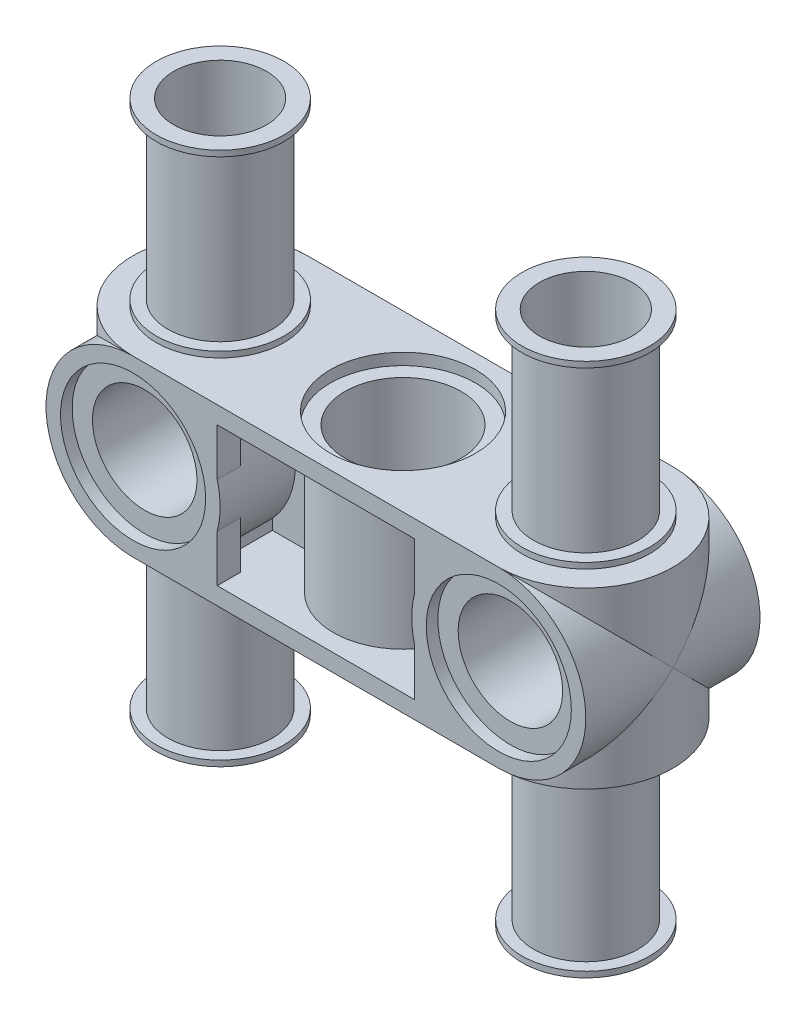
from build123d import *
from build123d.topology import SkipClean

# Parameters (mm, degrees)
EXTRUDE1_DEPTH     = 3.81
SKETCH2_R          = 2.794
CUT_EXTRUDE1_DEPTH = 0.254
SKETCH3_R          = 2.794
EXTRUDE2_DEPTH     = 0.254
SKETCH5_R          = 2.286
SKETCH5_R_2        = 2.032
EXTRUDE4_DEPTH     = 7.366
SKETCH6_R          = 2.794
SKETCH6_R_2        = 2.032
EXTRUDE5_DEPTH     = 0.254
EXTRUDE6_DEPTH     = 7.112
SKETCH8_R          = 2.54
CUT_EXTRUDE2_DEPTH = 3.556
SKETCH9_R          = 2.286
CUT_EXTRUDE3_DEPTH = 17.110989945
SKETCH10_R         = 3.175
CUT_EXTRUDE4_DEPTH = 0.508
CUT_EXTRUDE6_DEPTH = 3.048
SKETCH13_R         = 2.54
CUT_EXTRUDE7_DEPTH = 15.835100543
SKETCH14_R         = 3.175
CUT_EXTRUDE8_DEPTH = 0.508
EXTRUDE8_START     = -7.112
EXTRUDE8_DEPTH     = 7.112


with BuildPart() as part:
    # Sketch1 → Extrude1 (new body)
    with BuildSketch(Plane(origin=(0, 0, 0), x_dir=(1, 0, 0), z_dir=(0, 1, 0))):
        with BuildLine():
            Line((-8.001, 3.81), (8.001, 3.81))
            ThreePointArc((8.001, 3.81), (11.811, 0), (8.001, -3.81))
            Line((8.001, -3.81), (-8.001, -3.81))
            ThreePointArc((-8.001, -3.81), (-11.811, 0), (-8.001, 3.81))
        make_face()
    extrude(amount=EXTRUDE1_DEPTH)

    # Sketch2 → Cut-Extrude1 (cut)
    with BuildSketch(Plane.XZ):
        with Locations(Location((0, 0, 0), (0, 0, 270))):
            Circle(SKETCH2_R)
    extrude(amount=-CUT_EXTRUDE1_DEPTH, mode=Mode.SUBTRACT)

    # Sketch3 → Extrude2 (add)
    with BuildSketch(Plane.XZ):
        with Locations(Location((8.001, 0, 0), (0, 0, 90))):
            Circle(SKETCH3_R)
        with Locations(Location((-8.001, 0, 0), (0, 0, 90))):
            Circle(SKETCH3_R)
    extrude(amount=EXTRUDE2_DEPTH)

    # Sketch5 → Extrude4 (add)
    # profile 1 of 2: a face of its own
    with BuildSketch(Plane.XZ.offset(0.254)):
        with Locations(Location((8.001, 0, 0), (0, 0, 270))):
            Circle(SKETCH5_R)
        with Locations(Location((8.001, 0, 0), (0, 0, 270))):
            Circle(SKETCH5_R_2, mode=Mode.SUBTRACT)
    # profile 2 of 2: a face of its own
    with BuildSketch(Plane.XZ.offset(0.254)):
        with Locations(Location((-8.001, 0, 0), (0, 0, 270))):
            Circle(SKETCH5_R)
        with Locations(Location((-8.001, 0, 0), (0, 0, 270))):
            Circle(SKETCH5_R_2, mode=Mode.SUBTRACT)
    extrude(amount=EXTRUDE4_DEPTH)

    # Sketch6 → Extrude5 (add)
    # profile 1 of 2: a face of its own
    with BuildSketch(Plane.XZ.offset(7.62)):
        with Locations(Location((-8.001, 0, 0), (0, 0, 90))):
            Circle(SKETCH6_R)
        with Locations(Location((-8.001, 0, 0), (0, 0, 270))):
            Circle(SKETCH6_R_2, mode=Mode.SUBTRACT)
    # profile 2 of 2: a face of its own
    with BuildSketch(Plane.XZ.offset(7.62)):
        with Locations(Location((8.001, 0, 0), (0, 0, 90))):
            Circle(SKETCH6_R)
        with Locations(Location((8.001, 0, 0), (0, 0, 270))):
            Circle(SKETCH6_R_2, mode=Mode.SUBTRACT)
    extrude(amount=EXTRUDE5_DEPTH)

    # Sketch7 → Extrude6 (add)
    with BuildSketch(Plane(origin=(0, 0, -3.81), x_dir=(-1, 0, 0), z_dir=(0, 0, -1))):
        with BuildLine():
            Line((-8.001, 0), (8.001, 0))
            ThreePointArc((8.001, 0), (10.695076836, 1.115923164), (11.811, 3.81))
            Line((11.811, 3.81), (8.001, 3.81))
            Line((8.001, 3.81), (-8.001, 3.81))
            Line((-8.001, 3.81), (-11.811, 3.81))
            ThreePointArc((-11.811, 3.81), (-10.695076836, 1.115923164), (-8.001, 0))
        make_face()
    extrude(amount=-EXTRUDE6_DEPTH)

    # Sketch8 → Cut-Extrude2 (cut)
    with BuildSketch(Plane(origin=(0, 3.81, 0), x_dir=(1, 0, 0), z_dir=(0, 1, 0))):
        with Locations(Location((0, 0, 0), (0, 0, 270))):
            Circle(SKETCH8_R)
    extrude(amount=-CUT_EXTRUDE2_DEPTH, mode=Mode.SUBTRACT)

    # Sketch9 → Cut-Extrude3 (cut, through all)
    with BuildSketch(Plane.XY.offset(3.81)):
        with Locations((8.001, 3.81)):
            Circle(SKETCH9_R)
        with Locations((-8.001, 3.81)):
            Circle(SKETCH9_R)
    extrude(amount=-CUT_EXTRUDE3_DEPTH, mode=Mode.SUBTRACT)

    # Sketch10 → Cut-Extrude4 (cut)
    with BuildSketch(Plane.XY.offset(3.81)):
        with Locations((8.001, 3.81)):
            Circle(SKETCH10_R)
        with Locations((-8.001, 3.81)):
            Circle(SKETCH10_R)
    cut_extrude4 = extrude(amount=-CUT_EXTRUDE4_DEPTH, mode=Mode.SUBTRACT)

    # Mirror2: Cut-Extrude4 across plane
    add(cut_extrude4.mirror(Plane.XY), mode=Mode.SUBTRACT)

    # Sketch11 → Cut-Extrude6 (cut)
    with BuildSketch(Plane(origin=(0, 3.81, 0), x_dir=(1, 0, 0), z_dir=(0, 1, 0))):
        with BuildLine():
            Line((-5.207, -0.508), (-5.207, -2.794))
            Line((-5.207, -2.794), (-4.318, -2.794))
            Line((-4.318, -2.794), (-4.318, -3.81))
            Line((-4.318, -3.81), (4.318, -3.81))
            Line((4.318, -3.81), (4.318, -2.794))
            Line((4.318, -2.794), (5.207, -2.794))
            Line((5.207, -2.794), (5.207, -0.508))
            Line((5.207, -0.508), (3.00536853, -0.508))
            ThreePointArc((3.00536853, -0.508), (0, -3.048), (-3.00536853, -0.508))
            Line((-3.00536853, -0.508), (-5.207, -0.508))
        make_face()
        with BuildLine():
            Line((5.207, 0.508), (5.207, 2.794))
            Line((5.207, 2.794), (4.318, 2.794))
            Line((4.318, 2.794), (4.318, 3.81))
            Line((4.318, 3.81), (-4.318, 3.81))
            Line((-4.318, 3.81), (-4.318, 2.794))
            Line((-4.318, 2.794), (-5.207, 2.794))
            Line((-5.207, 2.794), (-5.207, 0.508))
            Line((-5.207, 0.508), (-3.00536853, 0.508))
            ThreePointArc((-3.00536853, 0.508), (0, 3.048), (3.00536853, 0.508))
            Line((3.00536853, 0.508), (5.207, 0.508))
        make_face()
    extrude(amount=-CUT_EXTRUDE6_DEPTH, mode=Mode.SUBTRACT)

    # Sketch13 → Cut-Extrude7 (cut, through all)
    with BuildSketch(Plane(origin=(0, 0.254, 0), x_dir=(1, 0, 0), z_dir=(0, 1, 0))):
        with Locations(Location((0, 0, 0), (0, 0, 270))):
            Circle(SKETCH13_R)
    extrude(amount=-CUT_EXTRUDE7_DEPTH, mode=Mode.SUBTRACT)

    # Sketch14 → Cut-Extrude8 (cut)
    with BuildSketch(Plane.XZ):
        with Locations(Location((0, 0, 0), (0, 0, 270))):
            Circle(SKETCH14_R)
    extrude(amount=-CUT_EXTRUDE8_DEPTH, mode=Mode.SUBTRACT)

    # Sketch17 → Extrude8 (add)
    with BuildSketch(Plane.XY.offset(3.81).offset(EXTRUDE8_START)):
        with BuildLine():
            Line((-4.191, 3.81), (-4.826, 3.81))
            ThreePointArc((-4.826, 3.81), (-8.001, 0.635), (-11.176, 3.81))
            Line((-11.176, 3.81), (-11.811, 3.81))
            ThreePointArc((-11.811, 3.81), (-8.001, 0), (-4.191, 3.81))
        make_face()
    extrude8 = extrude(amount=EXTRUDE8_DEPTH)

    # Mirror3: Extrude8 across plane
    add(extrude8.mirror(Plane(origin=(0, 0, 0), x_dir=(0, 0, 1), z_dir=(1, 0, 0))))

    # Mirror1: part across face


with BuildPart() as part_1:
    with SkipClean():  # the faces are left unmerged after this step: merging them gives an invalid solid
        add(part.part)
        add(part.part.mirror(Plane(origin=(0, 3.81, 0.015780725), x_dir=(0, 0, 1), z_dir=(0, 1, 0))))


solid = part_1.part
